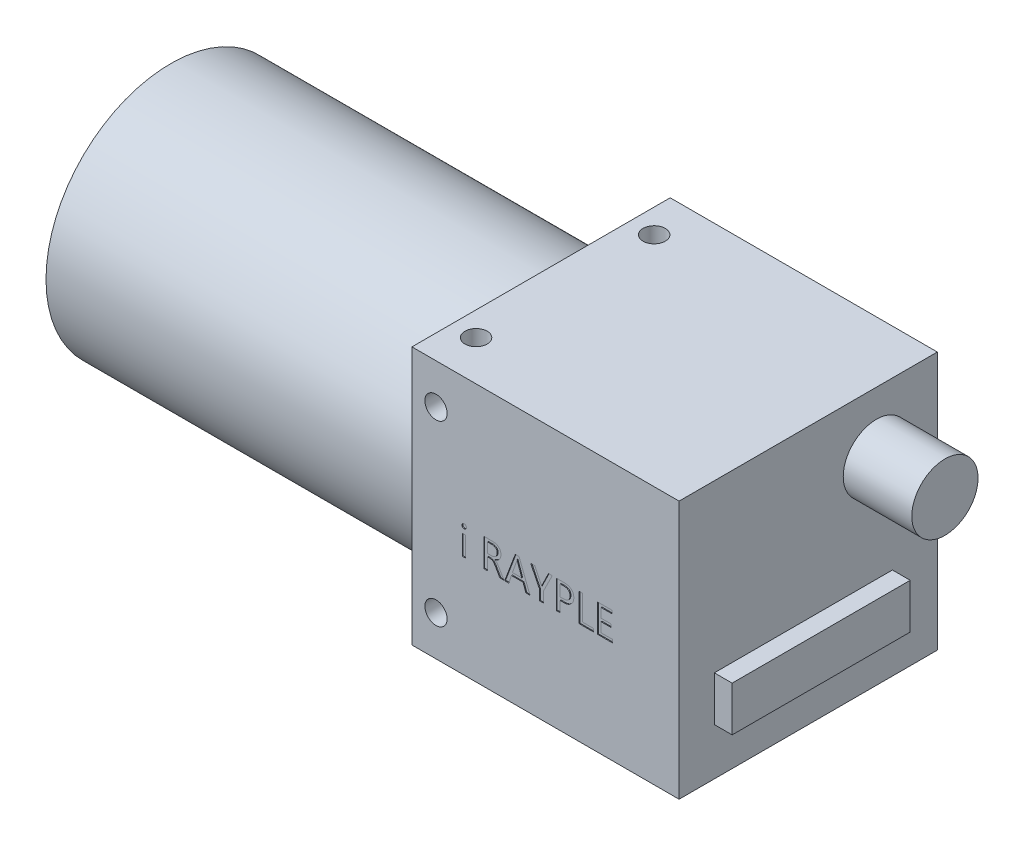
from build123d import *

# Parameters (mm, degrees)
SKETCH1_W           = 30
SKETCH1_H           = 29
BOSS_EXTRUDE1_DEPTH = 14.5
SKETCH4_R           = 14
BOSS_EXTRUDE2_DEPTH = 41.6
SKETCH5_R           = 3.721459909
BOSS_EXTRUDE3_DEPTH = 7.7
SKETCH6_W           = 20
SKETCH6_H           = 5.0357284
BOSS_EXTRUDE4_DEPTH = 2
SKETCH7_R           = 1.25
CUT_EXTRUDE1_DEPTH  = 66.228904636
SKETCH8_R           = 1.25
CUT_EXTRUDE2_DEPTH  = 3.5
CUT_EXTRUDE3_START  = -3.5
SKETCH9_R           = 0.75
SKETCH9_R_2         = 1.25
CUT_EXTRUDE3_DEPTH  = 3.5
SKETCH10_W          = 0.384275193
SKETCH10_H          = 2.228796122
CUT_EXTRUDE4_DEPTH  = 0.1


with BuildPart() as part:
    # Sketch1 → Boss-Extrude1 (new, symmetric)
    with BuildSketch(Plane.XY):
        Rectangle(SKETCH1_W, SKETCH1_H)
    extrude(amount=BOSS_EXTRUDE1_DEPTH, both=True)

    # Sketch4 → Boss-Extrude2 (add)
    with BuildSketch(Plane.ZY.offset(15)):
        Circle(SKETCH4_R)
    extrude(amount=BOSS_EXTRUDE2_DEPTH)

    # Sketch5 → Boss-Extrude3 (add)
    with BuildSketch(Plane(origin=(15, 0, 0), x_dir=(0, 0, -1), z_dir=(1, 0, 0))):
        with Locations(Location((7.655668175, 7.655668175, 0), (0, 0, 180))):
            Circle(SKETCH5_R)
    extrude(amount=BOSS_EXTRUDE3_DEPTH)

    # Sketch6 → Boss-Extrude4 (add)
    with BuildSketch(Plane(origin=(15, 0, 0), x_dir=(0, 0, -1), z_dir=(1, 0, 0))):
        with Locations((-0.540996655, -6.7)):
            Rectangle(SKETCH6_W, SKETCH6_H)
    extrude(amount=BOSS_EXTRUDE4_DEPTH)

    # Sketch7 → Cut-Extrude1 (cut, through all)
    with BuildSketch(Plane.XY.offset(14.5)):
        with Locations((-12.3, 10)):
            Circle(SKETCH7_R)
        with Locations((-12.3, -10)):
            Circle(SKETCH7_R)
    extrude(amount=-CUT_EXTRUDE1_DEPTH, mode=Mode.SUBTRACT)

    # Sketch8 → Cut-Extrude2 (cut)
    with BuildSketch(Plane(origin=(0, 14.5, 0), x_dir=(1, 0, 0), z_dir=(0, 1, 0))):
        with Locations(Location((-12.3, 10, 0), (0, 0, 270))):
            Circle(SKETCH8_R)
        with Locations(Location((-12.3, -10, 0), (0, 0, 270))):
            Circle(SKETCH8_R)
    extrude(amount=-CUT_EXTRUDE2_DEPTH, mode=Mode.SUBTRACT)

    # Sketch9 → Cut-Extrude3 (cut)
    with BuildSketch(Plane.XZ.offset(14.5).offset(CUT_EXTRUDE3_START)):
        with Locations(Location((-11, 6, 0), (0, 0, 270))):
            Circle(SKETCH9_R)
        with Locations(Location((-11, -6, 0), (0, 0, 270))):
            Circle(SKETCH9_R)
        with Locations(Location((11, -6, 0), (0, 0, 270))):
            Circle(SKETCH9_R)
        with Locations(Location((11, 6, 0), (0, 0, 270))):
            Circle(SKETCH9_R)
        with Locations(Location((11, 0, 0), (0, 0, 270))):
            Circle(SKETCH9_R_2)
        with Locations(Location((-12.3, 10, 0), (0, 0, 90))):
            Circle(SKETCH9_R_2)
        with Locations(Location((-12.3, -10, 0), (0, 0, 90))):
            Circle(SKETCH9_R_2)
    extrude(amount=CUT_EXTRUDE3_DEPTH, mode=Mode.SUBTRACT)

    # Sketch10 → Cut-Extrude4 (cut)
    # profile 1 of 8: a face of its own
    with BuildSketch(Plane.XY.offset(14.5)):
        with BuildLine():
            add(Edge.make_bspline(
                [(-9.390012931, -0.020893889), (-9.389386506, -0.003761748), (-9.388162794, 0.029705585), (-9.373249887, 0.077134116), (-9.351720771, 0.121126274), (-9.320171101, 0.159030458), (-9.282741333, 0.190917515), (-9.240084966, 0.214244667), (-9.192889003, 0.227897148), (-9.160138343, 0.229736839), (-9.143236206, 0.230686277)],
                knots=[0, 0, 0, 0, 1.043030261, 2.037541102, 3.011077323, 4.019551348, 5.026392696, 6.000466463, 6.968069955, 8, 8, 8, 8], degree=3))
            add(Edge.make_bspline(
                [(-9.143236206, 0.230686277), (-9.126105254, 0.230056116), (-9.092640244, 0.22882511), (-9.04493578, 0.213883404), (-9.000673597, 0.191922921), (-8.9628567, 0.159649199), (-8.930750762, 0.121972379), (-8.9065104, 0.078771168), (-8.893386679, 0.030086702), (-8.89144909, -0.00360917), (-8.89045518, -0.020893889)],
                knots=[0, 0, 0, 0, 1.030096267, 2.012274774, 2.989987458, 3.993616006, 4.987972117, 5.966355974, 6.956816813, 8, 8, 8, 8], degree=3))
            add(Edge.make_bspline(
                [(-8.89045518, -0.020893889), (-8.891452043, -0.037975926), (-8.893395184, -0.071273161), (-8.906478674, -0.119423463), (-8.930998756, -0.161973657), (-8.962443239, -0.199744717), (-9.001122518, -0.230519405), (-9.044773363, -0.252910002), (-9.092767093, -0.266799768), (-9.126129381, -0.268169257), (-9.143236206, -0.268871475)],
                knots=[0, 0, 0, 0, 1.03800906, 2.023343677, 2.997589391, 3.998552222, 4.99351611, 5.97772493, 6.963059548, 8, 8, 8, 8], degree=3))
            add(Edge.make_bspline(
                [(-9.143236206, -0.268871475), (-9.160343337, -0.268179485), (-9.193513265, -0.266837749), (-9.240981011, -0.253028175), (-9.283606362, -0.230470675), (-9.321058296, -0.199675619), (-9.351435722, -0.161934734), (-9.374327854, -0.119096727), (-9.387893869, -0.07134044), (-9.389294662, -0.037993067), (-9.390012931, -0.020893889)],
                knots=[0, 0, 0, 0, 1.047455048, 2.030966374, 3.003372936, 3.989335003, 4.984812462, 5.957219023, 6.952544952, 8, 8, 8, 8], degree=3))
        make_face()
    # profile 2 of 8: a face of its own
    with BuildSketch(Plane.XY.offset(14.5)):
        with Locations((-9.159447816, -1.921254807)):
            Rectangle(SKETCH10_W, SKETCH10_H)
    # profile 3 of 8: a face of its own
    with BuildSketch(Plane.XY.offset(14.5)):
        with BuildLine():
            Line((-4.663428052, -3.035652868), (-5.124558284, -3.035652868))
            Line((-5.124558284, -3.035652868), (-5.636124635, -2.148817773))
            add(Edge.make_bspline(
                [(-5.636124635, -2.148817773), (-5.648614712, -2.127531026), (-5.67285108, -2.08622516), (-5.709817613, -2.027700861), (-5.746090721, -1.974446561), (-5.781316466, -1.926405189), (-5.816026824, -1.883557051), (-5.85050201, -1.846466176), (-5.883045757, -1.813557984), (-5.926409026, -1.778598783), (-5.982757907, -1.742478884), (-6.057055878, -1.712508819), (-6.137369849, -1.69387441), (-6.193019278, -1.691768917), (-6.221543875, -1.690689691)],
                knots=[0, 0, 0, 0, 1.130740819, 2.194145845, 3.170827357, 4.082355974, 4.923051463, 5.695349335, 6.402154369, 7.0409034, 8.244273015, 9.453324277, 10.69463355, 12, 12, 12, 12], degree=3))
            Line((-6.221543875, -1.690689691), (-6.50794898, -1.690689691))
            Line((-6.50794898, -1.690689691), (-6.50794898, -3.035652868))
            Line((-6.50794898, -3.035652868), (-6.930651693, -3.035652868))
            Line((-6.930651693, -3.035652868), (-6.930651693, 0.115403719))
            Line((-6.930651693, 0.115403719), (-5.980171019, 0.115403719))
            add(Edge.make_bspline(
                [(-5.980171019, 0.115403719), (-5.943319245, 0.114708276), (-5.871471182, 0.113352406), (-5.766743318, 0.102933025), (-5.667888052, 0.086466493), (-5.575160585, 0.06262644), (-5.488804202, 0.031205333), (-5.408560359, -0.006711121), (-5.334113436, -0.051015897), (-5.266863092, -0.10308245), (-5.205991107, -0.160381273), (-5.153160436, -0.224115268), (-5.108845776, -0.293472398), (-5.071587707, -0.367936881), (-5.043580111, -0.448101961), (-5.023852652, -0.533681906), (-5.011667042, -0.624576728), (-5.010086044, -0.687132091), (-5.009275726, -0.719193967)],
                knots=[0, 0, 0, 0, 1.218895871, 2.376420411, 3.477962383, 4.53141632, 5.538862009, 6.513239363, 7.463634743, 8.398567947, 9.321158646, 10.2239854, 11.129406106, 12.03842662, 12.972374671, 13.931150821, 14.93964027, 16, 16, 16, 16], degree=3))
            add(Edge.make_bspline(
                [(-5.009275726, -0.719193967), (-5.009610201, -0.745639692), (-5.010268281, -0.797671796), (-5.019189835, -0.873677486), (-5.032057526, -0.94623345), (-5.050842072, -1.015122778), (-5.074802707, -1.080666103), (-5.104079806, -1.14275602), (-5.139530893, -1.2006215), (-5.178998331, -1.25582221), (-5.224974574, -1.30685314), (-5.276213854, -1.354202387), (-5.332109127, -1.398499138), (-5.394218069, -1.437801061), (-5.460515607, -1.475450578), (-5.533061111, -1.508141675), (-5.610604233, -1.537829609), (-5.664825692, -1.553950384), (-5.692565054, -1.562197673)],
                knots=[0, 0, 0, 0, 1.074656955, 2.114393259, 3.107181087, 4.068555706, 5.013394394, 5.941580924, 6.854299593, 7.76908369, 8.696949116, 9.641262007, 10.603359607, 11.592003282, 12.626631854, 13.700826558, 14.823757099, 16, 16, 16, 16], degree=3))
            Line((-5.692565054, -1.562197673), (-5.692565054, -1.572404983))
            add(Edge.make_bspline(
                [(-5.692565054, -1.572404983), (-5.671513439, -1.582161413), (-5.629636582, -1.601569361), (-5.57126664, -1.638564123), (-5.517398642, -1.681536922), (-5.475943186, -1.722736551), (-5.44344878, -1.759929453), (-5.417834265, -1.792856145), (-5.389058762, -1.829188766), (-5.36033535, -1.871630446), (-5.328239655, -1.91740244), (-5.295274026, -1.968229853), (-5.260390808, -2.023439755), (-5.236973241, -2.06211503), (-5.224830092, -2.082170044)],
                knots=[0, 0, 0, 0, 1.184822924, 2.356905208, 3.521464881, 4.700445098, 5.338415513, 6.044500847, 6.832186772, 7.706197801, 8.662360415, 9.68937721, 10.801829505, 12, 12, 12, 12], degree=3))
            Line((-5.224830092, -2.082170044), (-4.663428052, -3.035652868))
        make_face()
        with BuildLine():
            Line((-6.50794898, -0.230443956), (-6.50794898, -1.344842017))
            Line((-6.50794898, -1.344842017), (-6.041414878, -1.344842017))
            add(Edge.make_bspline(
                [(-6.041414878, -1.344842017), (-6.019371458, -1.344462148), (-5.976139938, -1.34371715), (-5.912915507, -1.335467253), (-5.852678948, -1.323304649), (-5.795876097, -1.304974604), (-5.742197856, -1.282100022), (-5.691410253, -1.254595283), (-5.644249149, -1.221128012), (-5.600649976, -1.182841661), (-5.561112207, -1.140466214), (-5.526729924, -1.094422516), (-5.497123202, -1.045683965), (-5.472683352, -0.993692859), (-5.455033711, -0.93803359), (-5.441898566, -0.879581317), (-5.432931865, -0.81793867), (-5.432301345, -0.775667206), (-5.431978439, -0.754018907)],
                knots=[0, 0, 0, 0, 1.107295592, 2.171626293, 3.199536045, 4.192135932, 5.165640131, 6.129060805, 7.089167039, 8.0657848, 9.040950802, 9.996619902, 10.948947584, 11.903080024, 12.876532246, 13.877103319, 14.912810223, 16, 16, 16, 16], degree=3))
            add(Edge.make_bspline(
                [(-5.431978439, -0.754018907), (-5.432408538, -0.733980842), (-5.433245886, -0.694969305), (-5.440660114, -0.638089943), (-5.452472632, -0.58454331), (-5.469333434, -0.534399667), (-5.491042123, -0.487513603), (-5.518250261, -0.444454536), (-5.549581801, -0.404349239), (-5.585944852, -0.368152714), (-5.626828024, -0.335727833), (-5.672299139, -0.307267578), (-5.722055045, -0.28335536), (-5.776500583, -0.264122886), (-5.834875475, -0.248561336), (-5.897967522, -0.237747436), (-5.965254986, -0.232066255), (-6.011583687, -0.230994936), (-6.035410578, -0.230443956)],
                knots=[0, 0, 0, 0, 1.058384684, 2.060538898, 3.025220841, 3.951579121, 4.850487263, 5.748399523, 6.636984035, 7.534335625, 8.452630291, 9.388656851, 10.363028537, 11.363227871, 12.435470195, 13.551662397, 14.740817851, 16, 16, 16, 16], degree=3))
            Line((-6.035410578, -0.230443956), (-6.50794898, -0.230443956))
        make_face(mode=Mode.SUBTRACT)
    # profile 4 of 8: a face of its own
    with BuildSketch(Plane.XY.offset(14.5)):
        Polygon((-1.742936581, -3.035652868), (-2.204066814, -3.035652868), (-2.522895138, -2.151819923), (-3.824627356, -2.151819923), (-4.125442781, -3.035652868), (-4.586573013, -3.035652868), (-3.395319913, 0.115403719), (-2.972617201, 0.115403719), align=None)
        with BuildLine():
            Line((-2.664596616, -1.805972249), (-3.138936308, -0.489829711))
            add(Edge.make_bspline(
                [(-3.138936308, -0.489829711), (-3.142868527, -0.477257517), (-3.151844523, -0.448559233), (-3.163606812, -0.399027586), (-3.175138998, -0.337791049), (-3.183201579, -0.293094825), (-3.187571137, -0.268871475)],
                knots=[0, 0, 0, 0, 0.697926861, 1.593143037, 2.69559139, 4, 4, 4, 4], degree=3))
            Line((-3.187571137, -0.268871475), (-3.197778447, -0.268871475))
            add(Edge.make_bspline(
                [(-3.197778447, -0.268871475), (-3.201452839, -0.291309809), (-3.20839407, -0.333697689), (-3.220111237, -0.393091883), (-3.233157054, -0.444422), (-3.243451984, -0.47546758), (-3.248214566, -0.489829711)],
                knots=[0, 0, 0, 0, 1.202164453, 2.270988586, 3.200134455, 4, 4, 4, 4], degree=3))
            Line((-3.248214566, -0.489829711), (-3.718351248, -1.805972249))
            Line((-3.718351248, -1.805972249), (-2.664596616, -1.805972249))
        make_face(mode=Mode.SUBTRACT)
    # profile 5 of 8: a face of its own
    with BuildSketch(Plane.XY.offset(14.5)):
        with BuildLine():
            Line((0.754852176, 0.115403719), (-0.244263327, -1.892434167))
            Line((-0.244263327, -1.892434167), (-0.244263327, -3.035652868))
            Line((-0.244263327, -3.035652868), (-0.66696604, -3.035652868))
            Line((-0.66696604, -3.035652868), (-0.66696604, -1.902641477))
            Line((-0.66696604, -1.902641477), (-1.666081543, 0.115403719))
            Line((-1.666081543, 0.115403719), (-1.204951311, 0.115403719))
            Line((-1.204951311, 0.115403719), (-0.523463272, -1.303412347))
            add(Edge.make_bspline(
                [(-0.523463272, -1.303412347), (-0.522843419, -1.304604727), (-0.520644597, -1.308834489), (-0.517405693, -1.318889605), (-0.511174316, -1.334999635), (-0.502867906, -1.357588382), (-0.492808004, -1.386530773), (-0.479993622, -1.421483344), (-0.465144188, -1.462771056), (-0.454236199, -1.492355809), (-0.448409523, -1.508158974)],
                knots=[0, 0, 0, 0, 0.147743287, 0.524094158, 1.158224838, 2.050139749, 3.171648737, 4.530208759, 6.146556032, 8, 8, 8, 8], degree=3))
            Line((-0.448409523, -1.508158974), (-0.442405224, -1.508158974))
            add(Edge.make_bspline(
                [(-0.442405224, -1.508158974), (-0.437993969, -1.492885895), (-0.428784077, -1.460998497), (-0.410285687, -1.4119573), (-0.387527633, -1.359613912), (-0.370277376, -1.323769668), (-0.361347175, -1.305213637)],
                knots=[0, 0, 0, 0, 0.871330364, 1.819178638, 2.871021336, 4, 4, 4, 4], degree=3))
            Line((-0.361347175, -1.305213637), (0.332149463, 0.115403719))
            Line((0.332149463, 0.115403719), (0.754852176, 0.115403719))
        make_face()
    # profile 6 of 8: a face of its own
    with BuildSketch(Plane.XY.offset(14.5)):
        with BuildLine():
            Line((1.638685121, -1.844399768), (1.638685121, -3.035652868))
            Line((1.638685121, -3.035652868), (1.215982408, -3.035652868))
            Line((1.215982408, -3.035652868), (1.215982408, 0.115403719))
            Line((1.215982408, 0.115403719), (2.107020513, 0.115403719))
            add(Edge.make_bspline(
                [(2.107020513, 0.115403719), (2.148278986, 0.114807492), (2.228362638, 0.113650201), (2.344963085, 0.101967296), (2.454454689, 0.083116332), (2.55687286, 0.056029234), (2.652455263, 0.021815136), (2.741071994, -0.019939876), (2.822006607, -0.070463192), (2.896240299, -0.127152244), (2.961982242, -0.191853522), (3.019366997, -0.263189189), (3.068526312, -0.340896503), (3.107439647, -0.425927021), (3.138128873, -0.517110253), (3.160251305, -0.61484847), (3.17367093, -0.719219284), (3.175068253, -0.791004245), (3.175785895, -0.827871795)],
                knots=[0, 0, 0, 0, 1.221496758, 2.370953492, 3.466229561, 4.50853695, 5.504092727, 6.469115662, 7.403359976, 8.324520871, 9.229832985, 10.127722387, 11.030547589, 11.94541344, 12.890072117, 13.874984866, 14.908627926, 16, 16, 16, 16], degree=3))
            add(Edge.make_bspline(
                [(3.175785895, -0.827871795), (3.175006796, -0.865359509), (3.173474792, -0.939074612), (3.157170432, -1.046626767), (3.132261557, -1.148972768), (3.096601826, -1.245664469), (3.050714789, -1.336930202), (2.994597039, -1.422449923), (2.92834403, -1.502569452), (2.852642699, -1.576171519), (2.769325779, -1.642639701), (2.680490654, -1.700665056), (2.586006643, -1.748139074), (2.486922631, -1.786765236), (2.382682868, -1.816589126), (2.272938465, -1.835100886), (2.158477825, -1.845956316), (2.080624943, -1.844925022), (2.040973214, -1.844399768)],
                knots=[0, 0, 0, 0, 1.047567089, 2.059915297, 3.034553849, 3.988992129, 4.935123622, 5.885153844, 6.843260912, 7.836680967, 8.832258631, 9.819590091, 10.798269876, 11.783568742, 12.78991175, 13.824162436, 14.891810808, 16, 16, 16, 16], degree=3))
            Line((2.040973214, -1.844399768), (1.638685121, -1.844399768))
        make_face()
        with BuildLine():
            Line((1.638685121, -0.230443956), (1.638685121, -1.498552094))
            Line((1.638685121, -1.498552094), (2.007949565, -1.498552094))
            add(Edge.make_bspline(
                [(2.007949565, -1.498552094), (2.03759785, -1.498250375), (2.095022911, -1.497665982), (2.178406252, -1.488617183), (2.256430655, -1.476070262), (2.328826381, -1.457138682), (2.396119096, -1.434142193), (2.457358196, -1.404554009), (2.513364887, -1.370010148), (2.563854753, -1.330470552), (2.608704947, -1.285776023), (2.64728321, -1.235961514), (2.680597004, -1.182005718), (2.706882452, -1.1228679), (2.728230175, -1.059856643), (2.742122081, -0.991864918), (2.75155139, -0.919602057), (2.752562886, -0.86973446), (2.753083182, -0.844083405)],
                knots=[0, 0, 0, 0, 1.257807907, 2.436218341, 3.556349562, 4.609289964, 5.608814519, 6.570169625, 7.489619625, 8.397178748, 9.286258589, 10.169964329, 11.066038699, 11.970929755, 12.911220345, 13.884328166, 14.911733895, 16, 16, 16, 16], degree=3))
            add(Edge.make_bspline(
                [(2.753083182, -0.844083405), (2.752426507, -0.819247917), (2.751152179, -0.771052769), (2.743645558, -0.701246384), (2.729861603, -0.63620446), (2.709820815, -0.576237333), (2.685523839, -0.520230755), (2.654458254, -0.469789993), (2.618927133, -0.423391826), (2.577254927, -0.38244095), (2.529607446, -0.346695825), (2.476771451, -0.315657542), (2.41848967, -0.288934296), (2.354632883, -0.267562306), (2.285316005, -0.250811888), (2.210626209, -0.239005688), (2.130383288, -0.231691982), (2.075014103, -0.230869397), (2.046377084, -0.230443956)],
                knots=[0, 0, 0, 0, 1.111901111, 2.157728374, 3.138310241, 4.081801531, 4.984240268, 5.864706733, 6.726745576, 7.594723825, 8.470986253, 9.386802377, 10.332970003, 11.335972228, 12.39643462, 13.521791194, 14.718266964, 16, 16, 16, 16], degree=3))
            Line((2.046377084, -0.230443956), (1.638685121, -0.230443956))
        make_face(mode=Mode.SUBTRACT)
    # profile 7 of 8: a face of its own
    with BuildSketch(Plane.XY.offset(14.5)):
        Polygon((5.366154498, -3.035652868), (3.752198685, -3.035652868), (3.752198685, 0.115403719), (4.174901398, 0.115403719), (4.174901398, -2.689805194), (5.366154498, -2.689805194), align=None)
    # profile 8 of 8: a face of its own
    with BuildSketch(Plane.XY.offset(14.5)):
        Polygon((7.518095581, -3.035652868), (5.82728473, -3.035652868), (5.82728473, 0.115403719), (7.441240542, 0.115403719), (7.441240542, -0.230443956), (6.249987443, -0.230443956), (6.249987443, -1.267986978), (7.364385504, -1.267986978), (7.364385504, -1.613834652), (6.249987443, -1.613834652), (6.249987443, -2.689805194), (7.518095581, -2.689805194), align=None)
    extrude(amount=-CUT_EXTRUDE4_DEPTH, mode=Mode.SUBTRACT)


solid = part.part
